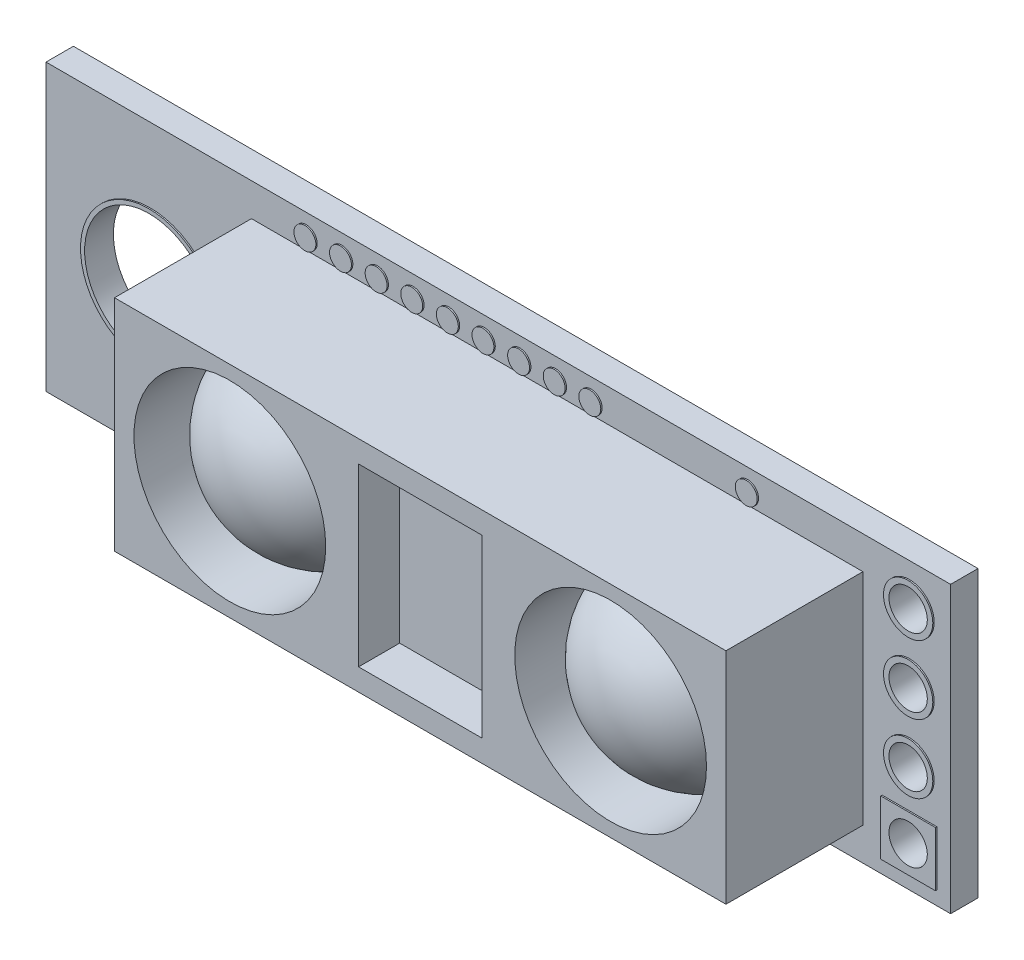
from build123d import *

# Parameters (mm, degrees)
CROQUIS1_W              = 33.02
CROQUIS1_H              = 10.414
SALIENTE_EXTRUIR1_DEPTH = 0.5
CROQUIS2_R              = 2.5
CROQUIS2_R_2            = 2.35
CROQUIS2_R_3            = 0.9
CROQUIS2_R_4            = 0.7
CROQUIS2_W              = 2
CROQUIS2_H              = 2
SALIENTE_EXTRUIR2_DEPTH = 0.05
CORTAR_EXTRUIR1_START   = -30.1
CROQUIS3_R              = 2.35
CROQUIS3_R_2            = 0.7
CORTAR_EXTRUIR1_DEPTH   = 30.1
CROQUIS4_R              = 0.7
CORTAR_EXTRUIR2_DEPTH   = 40.1
CROQUIS5_W              = 22.32
CROQUIS5_H              = 8.014
SALIENTE_EXTRUIR3_DEPTH = 5
CROQUIS6_W              = 4.5
CROQUIS6_H              = 6.414
CORTAR_EXTRUIR3_DEPTH   = 1.5
CROQUIS7_R              = 3.5
CORTAR_EXTRUIR4_DEPTH   = 3
C_PULA1_FACE_RADIUS     = 3.5
C_PULA1_HEIGHT          = 3
C_PULA2_FACE_RADIUS     = 3.5
C_PULA2_HEIGHT          = 3.2
CROQUIS8_R              = 0.4
SALIENTE_EXTRUIR4_DEPTH = 0.05


with BuildPart() as part:
    # Croquis1 → Saliente-Extruir1 (new, symmetric)
    with BuildSketch(Plane.XY):
        Rectangle(CROQUIS1_W, CROQUIS1_H)
    extrude(amount=SALIENTE_EXTRUIR1_DEPTH, both=True)

    # Croquis2 → Saliente-Extruir2 (add)
    # profile 1 of 5: a face of its own
    with BuildSketch(Plane.XY.offset(0.5)):
        with Locations((-12.7, 0)):
            Circle(CROQUIS2_R)
        with Locations((-12.7, 0)):
            Circle(CROQUIS2_R_2, mode=Mode.SUBTRACT)
    # profile 2 of 5: a face of its own
    with BuildSketch(Plane.XY.offset(0.5)):
        with Locations((15.01, 3.707)):
            Circle(CROQUIS2_R_3)
        with Locations((15.01, 3.707)):
            Circle(CROQUIS2_R_4, mode=Mode.SUBTRACT)
    # profile 3 of 5: a face of its own
    with BuildSketch(Plane.XY.offset(0.5)):
        with Locations((15.01, 1.207)):
            Circle(CROQUIS2_R_3)
        with Locations((15.01, 1.207)):
            Circle(CROQUIS2_R_4, mode=Mode.SUBTRACT)
    # profile 4 of 5: a face of its own
    with BuildSketch(Plane.XY.offset(0.5)):
        with Locations((15.01, -1.293)):
            Circle(CROQUIS2_R_3)
        with Locations((15.01, -1.293)):
            Circle(CROQUIS2_R_4, mode=Mode.SUBTRACT)
    # profile 5 of 5: a face of its own
    with BuildSketch(Plane.XY.offset(0.5)):
        with Locations((15.01, -3.707)):
            Rectangle(CROQUIS2_W, CROQUIS2_H)
    extrude(amount=SALIENTE_EXTRUIR2_DEPTH)

    # Croquis3 → Cortar-Extruir1 (cut)
    with BuildSketch(Plane.XY.offset(0.5).offset(CORTAR_EXTRUIR1_START)):
        with Locations((-12.7, 0)):
            Circle(CROQUIS3_R)
        with Locations((15.01, 3.707)):
            Circle(CROQUIS3_R_2)
        with Locations((15.01, 1.207)):
            Circle(CROQUIS3_R_2)
        with Locations((15.01, -1.293)):
            Circle(CROQUIS3_R_2)
    extrude(amount=CORTAR_EXTRUIR1_DEPTH, mode=Mode.SUBTRACT)

    # Croquis4 → Cortar-Extruir2 (cut)
    with BuildSketch(Plane.XY.offset(0.55)):
        with Locations((15.01, -3.707)):
            Circle(CROQUIS4_R)
    extrude(amount=-CORTAR_EXTRUIR2_DEPTH, mode=Mode.SUBTRACT)

    # Croquis5 → Saliente-Extruir3 (add)
    with BuildSketch(Plane.XY.offset(0.5)):
        with Locations((2.15, 0)):
            Rectangle(CROQUIS5_W, CROQUIS5_H)
    extrude(amount=SALIENTE_EXTRUIR3_DEPTH)

    # Croquis6 → Cortar-Extruir3 (cut)
    with BuildSketch(Plane.XY.offset(5.5)):
        with Locations((2.15, 0)):
            Rectangle(CROQUIS6_W, CROQUIS6_H)
    extrude(amount=-CORTAR_EXTRUIR3_DEPTH, mode=Mode.SUBTRACT)

    # Croquis7 → Cortar-Extruir4 (cut)
    with BuildSketch(Plane.XY.offset(5.5)):
        with Locations((-4.8, 0)):
            Circle(CROQUIS7_R)
        with Locations((9.1, 0)):
            Circle(CROQUIS7_R)
    extrude(amount=-CORTAR_EXTRUIR4_DEPTH, mode=Mode.SUBTRACT)

    # Cúpula1: a dome of height H over a round flat face of radius A is a cap of a sphere of radius (A * A + H * H) / (2 * H)
    c_pula1_r = (C_PULA1_FACE_RADIUS * C_PULA1_FACE_RADIUS + C_PULA1_HEIGHT * C_PULA1_HEIGHT) / (2 * C_PULA1_HEIGHT)
    c_pula1_base = Plane((-4.8, 0, 2.5), z_dir=(0, 0, 1))
    with Locations(c_pula1_base.offset(C_PULA1_HEIGHT - c_pula1_r)):
        c_pula1_ball = Sphere(c_pula1_r, mode=Mode.PRIVATE)
    add(split(c_pula1_ball, bisect_by=c_pula1_base, keep=Keep.TOP, mode=Mode.PRIVATE))

    # Cúpula2: a dome of height H over a round flat face of radius A is a cap of a sphere of radius (A * A + H * H) / (2 * H)
    c_pula2_r = (C_PULA2_FACE_RADIUS * C_PULA2_FACE_RADIUS + C_PULA2_HEIGHT * C_PULA2_HEIGHT) / (2 * C_PULA2_HEIGHT)
    c_pula2_base = Plane((9.1, 0, 2.5), z_dir=(0, 0, 1))
    with Locations(c_pula2_base.offset(C_PULA2_HEIGHT - c_pula2_r)):
        c_pula2_ball = Sphere(c_pula2_r, mode=Mode.PRIVATE)
    add(split(c_pula2_ball, bisect_by=c_pula2_base, keep=Keep.TOP, mode=Mode.PRIVATE))

    # Croquis8 → Saliente-Extruir4 (add)
    with BuildSketch(Plane.XY.offset(0.5)):
        with Locations((9.1, 4.417)):
            Circle(CROQUIS8_R)
        with Locations((-7.01, 4.417)):
            Circle(CROQUIS8_R)
        with Locations((-5.71, 4.417)):
            Circle(CROQUIS8_R)
        with Locations((-4.41, 4.417)):
            Circle(CROQUIS8_R)
        with Locations((-3.11, 4.417)):
            Circle(CROQUIS8_R)
        with Locations((-1.81, 4.417)):
            Circle(CROQUIS8_R)
        with Locations((-0.51, 4.417)):
            Circle(CROQUIS8_R)
        with Locations((0.79, 4.417)):
            Circle(CROQUIS8_R)
        with Locations((2.09, 4.417)):
            Circle(CROQUIS8_R)
        with Locations((3.39, 4.417)):
            Circle(CROQUIS8_R)
        with Locations((-7.01, -4.417)):
            Circle(CROQUIS8_R)
        with Locations((-5.71, -4.417)):
            Circle(CROQUIS8_R)
        with Locations((-4.41, -4.417)):
            Circle(CROQUIS8_R)
        with Locations((-3.11, -4.417)):
            Circle(CROQUIS8_R)
        with Locations((-1.81, -4.417)):
            Circle(CROQUIS8_R)
        with Locations((-0.51, -4.417)):
            Circle(CROQUIS8_R)
        with Locations((0.79, -4.417)):
            Circle(CROQUIS8_R)
        with Locations((2.09, -4.417)):
            Circle(CROQUIS8_R)
        with Locations((3.39, -4.417)):
            Circle(CROQUIS8_R)
        with Locations((9.1, -4.417)):
            Circle(CROQUIS8_R)
    extrude(amount=SALIENTE_EXTRUIR4_DEPTH)


solid = part.part
